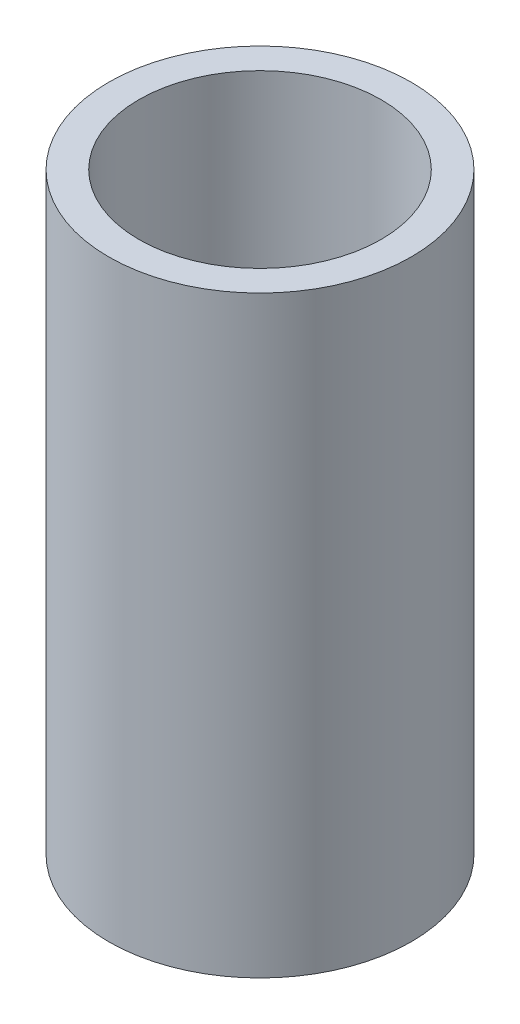
from build123d import *

# Parameters (mm, degrees)
SKETCH1_R           = 7.525
SKETCH1_R_2         = 6.025
BOSS_EXTRUDE1_DEPTH = 29.5


with BuildPart() as part:
    # Sketch1 → Boss-Extrude1 (new body)
    with BuildSketch(Plane(origin=(0, 0, 0), x_dir=(1, 0, 0), z_dir=(0, 1, 0))):
        with Locations(Location((0, 0, 0), (0, 0, 270))):
            Circle(SKETCH1_R)
        with Locations(Location((0, 0, 0), (0, 0, 270))):
            Circle(SKETCH1_R_2, mode=Mode.SUBTRACT)
    extrude(amount=BOSS_EXTRUDE1_DEPTH)


solid = part.part
